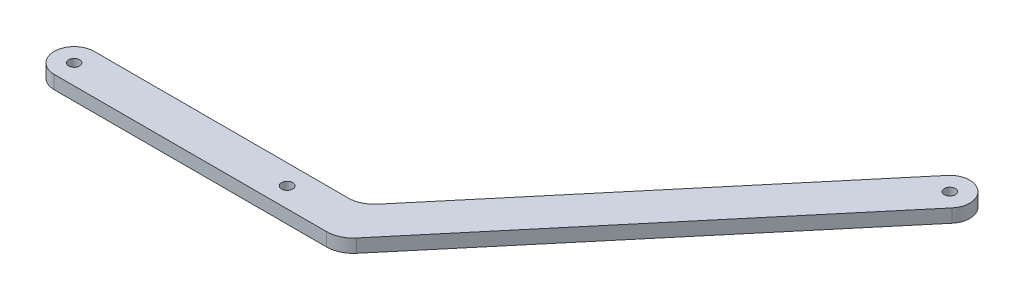
from build123d import *

# Parameters (mm, degrees)
SKETCH2_R           = 2.6035
SKETCH2_R_2         = 2.667
BOSS_EXTRUDE1_DEPTH = 6.35


with BuildPart() as part:
    # Sketch2 → Boss-Extrude1 (new body)
    with BuildSketch(Plane(origin=(0, 0, 0), x_dir=(1, 0, 0), z_dir=(0, 1, 0))):
        with BuildLine():
            Line((68.109325708, 14.275642301), (192.061641465, 161.996259914))
            ThreePointArc((192.061641465, 161.996259914), (205.480766768, 163.170281253), (206.654788106, 149.75115595))
            Line((206.654788106, 149.75115595), (76.992486596, -4.774357699))
            ThreePointArc((76.992486596, -4.774357699), (72.630974093, -8.121063952), (67.263722169, -9.310955056))
            Line((67.263722169, -9.310955056), (64.302668539, -9.310955056))
            Line((64.302668539, -9.310955056), (-62.697331461, -9.310955056))
            ThreePointArc((-62.697331461, -9.310955056), (-72.222331461, 0.214044944), (-62.697331461, 9.739044944))
            Line((-62.697331461, 9.739044944), (58.380561281, 9.739044944))
            ThreePointArc((58.380561281, 9.739044944), (63.747813205, 10.928936048), (68.109325708, 14.275642301))
        make_face()
        with Locations(Location((-62.697331461, 0.214044944, 0), (0, 0, 270))):
            Circle(SKETCH2_R, mode=Mode.SUBTRACT)
        with Locations(Location((199.358214786, 155.873707932, 0), (0, 0, 270))):
            Circle(SKETCH2_R, mode=Mode.SUBTRACT)
        with Locations(Location((38.902668539, 0.214044944, 0), (0, 0, 270))):
            Circle(SKETCH2_R_2, mode=Mode.SUBTRACT)
    extrude(amount=BOSS_EXTRUDE1_DEPTH)


solid = part.part
